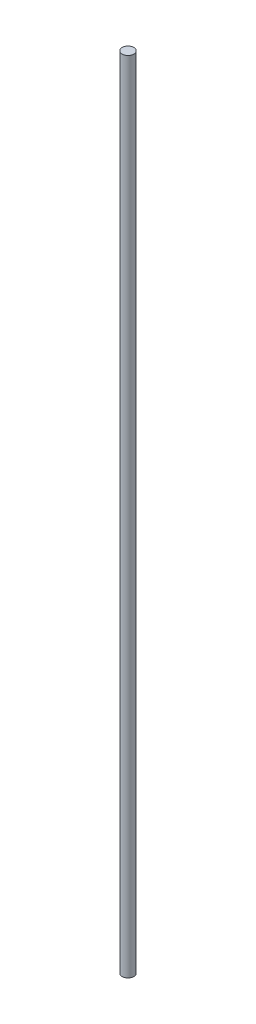
from build123d import *

# Parameters (mm, degrees)
CROQUIS1_R              = 4
SALIENTE_EXTRUIR1_DEPTH = 550


with BuildPart() as part:
    # Croquis1 → Saliente-Extruir1 (new body)
    with BuildSketch(Plane(origin=(0, 0, 0), x_dir=(1, 0, 0), z_dir=(0, 1, 0))):
        with Locations(Location((0, 0, 0), (0, 0, 270))):
            Circle(CROQUIS1_R)
    extrude(amount=SALIENTE_EXTRUIR1_DEPTH)


solid = part.part
